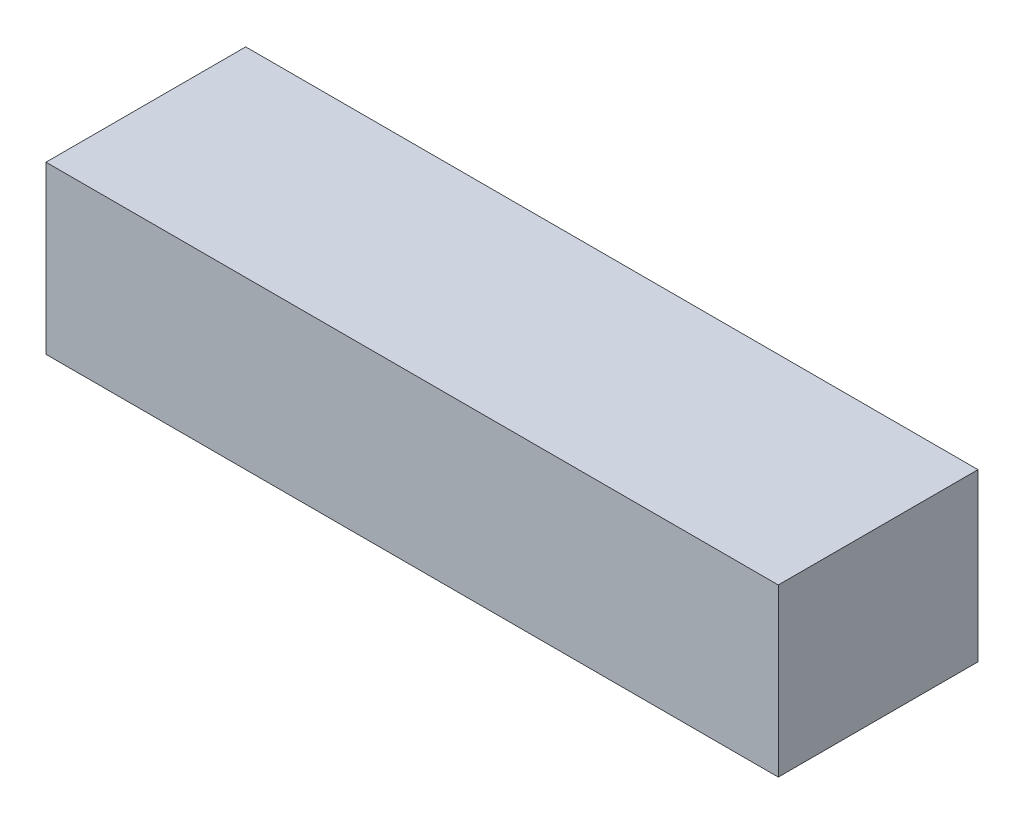
from build123d import *

# Parameters (mm, degrees)
SKETCH1_W           = 220
SKETCH1_H           = 60
BOSS_EXTRUDE1_DEPTH = 50


with BuildPart() as part:
    # Sketch1 → Boss-Extrude1 (new body)
    with BuildSketch(Plane(origin=(0, 0, 0), x_dir=(1, 0, 0), z_dir=(0, 1, 0))):
        with Locations((-37.278171987, 62.195121951)):
            Rectangle(SKETCH1_W, SKETCH1_H)
    extrude(amount=BOSS_EXTRUDE1_DEPTH)


solid = part.part
